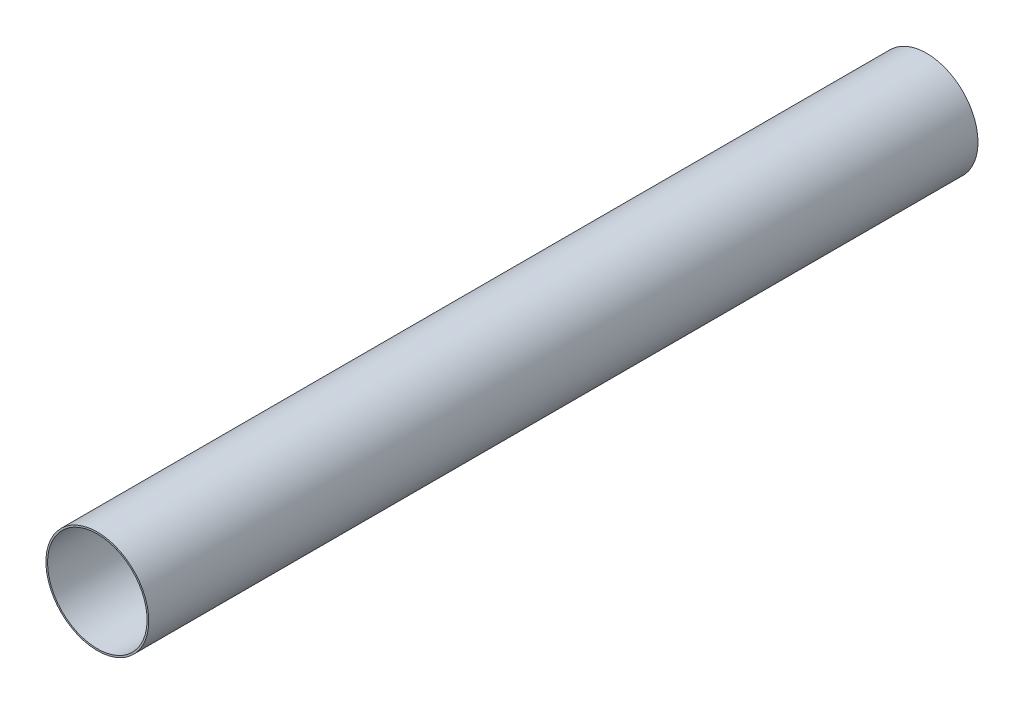
from build123d import *

# Parameters (mm, degrees)
SKETCH1_R           = 31
SKETCH1_R_2         = 30
EXTRUDE_THIN1_DEPTH = 500


with BuildPart() as part:
    # Sketch1 → Extrude-Thin1 (new body)
    with BuildSketch(Plane(origin=(0, 0, 0), x_dir=(0, 1, 0), z_dir=(0, 0, 1))):
        Circle(SKETCH1_R)
        Circle(SKETCH1_R_2, mode=Mode.SUBTRACT)
    extrude(amount=EXTRUDE_THIN1_DEPTH)


solid = part.part
